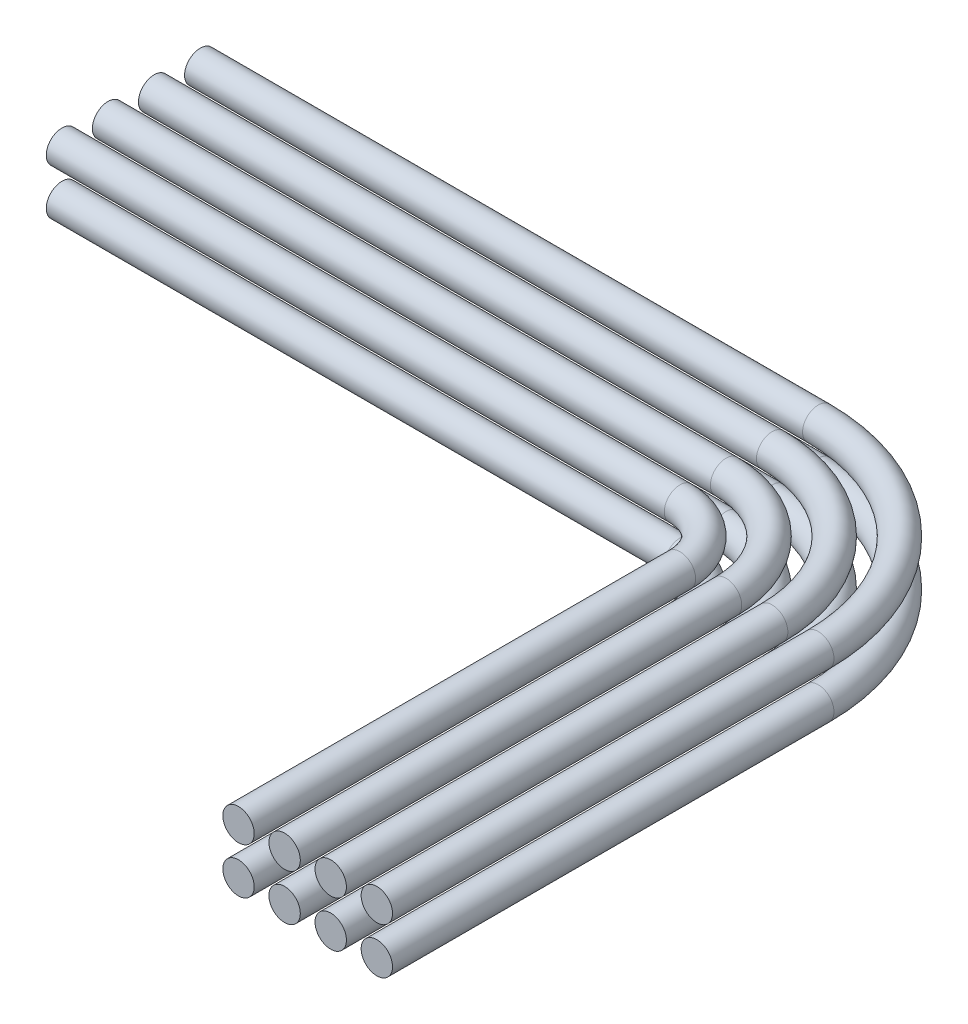
from build123d import *

# Parameters (mm, degrees)
SKETCH2_R       = 1.6
LPATTERN1_COUNT = 2
LPATTERN1_PITCH = 4.7


with BuildPart() as part:
    # Sweep1: sweep along a path in Sketch1
    with BuildLine(Plane(origin=(0, 0, 0), x_dir=(1, 0, 0), z_dir=(0, 1, 0))) as sweep1_path:
        Line((0, 0), (63, 0))
        ThreePointArc((63, 0), (77.142135624, -5.857864376), (83, -20))
        Line((83, -20), (83, -65))
    # Sketch2 → Sweep1 (sweep)
    with BuildSketch(Plane(origin=(0, 0, 0), x_dir=(0, 0, -1), z_dir=(1, 0, 0))):
        Circle(SKETCH2_R)
        with Locations((-4.7, 0)):
            Circle(SKETCH2_R)
        with Locations((-9.4, 0)):
            Circle(SKETCH2_R)
        with Locations((-14.1, 0)):
            Circle(SKETCH2_R)
    sweep1 = sweep(path=sweep1_path.line)


with BuildPart() as lpattern1_1:
    # LPattern1: Sweep1 ×2
    with Locations(*[(0, i * LPATTERN1_PITCH, 0) for i in range(1, LPATTERN1_COUNT)]):
        add(sweep1)


solid = Compound([part.part, lpattern1_1.part])
